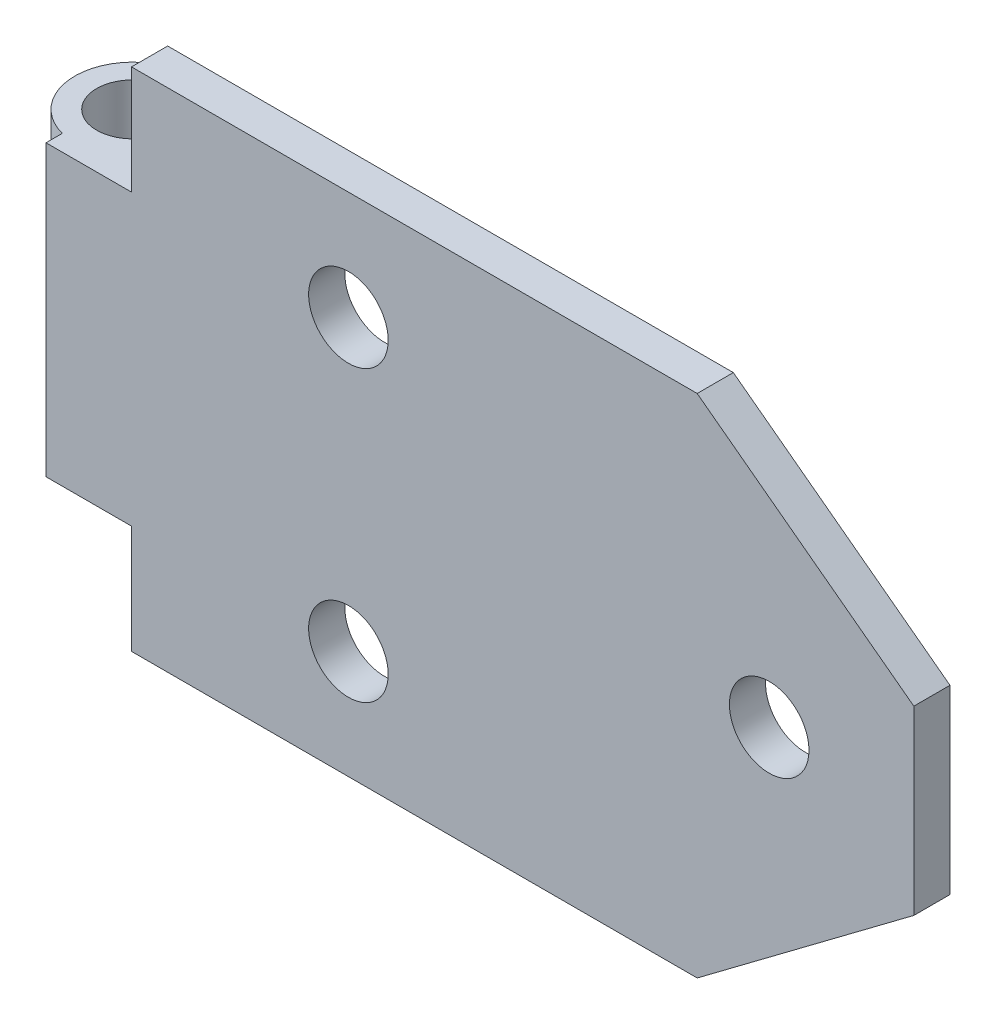
from build123d import *

# Parameters (mm, degrees)
SKETCH1_R               = 5.501178274
BOSS_EXTRUDE1_DEPTH     = 5
SKETCH2_R               = 8
SKETCH2_R_2             = 5
BOSS_EXTRUDE2_DEPTH     = 70
CUT_EXTRUDE2_DEPTH      = 140.531358483
CUT_EXTRUDE2_DEPTH_BACK = 140.531358483
SKETCH4_W               = 17.823798536
SKETCH4_H               = 15


with BuildPart() as part:
    # Sketch1 → Boss-Extrude1 (new body)
    with BuildSketch(Plane.XY):
        Polygon((0, 15), (11.823798536, 15), (11.823798536, 0), (90.043570566, 0), (120, 22.467322075), (120, 47.532677925), (90.043570566, 70), (11.823798536, 70), (11.823798536, 55), (0, 55), align=None)
        with Locations((41.814977969, 55)):
            Circle(SKETCH1_R, mode=Mode.SUBTRACT)
        with Locations((41.814977969, 15)):
            Circle(SKETCH1_R, mode=Mode.SUBTRACT)
        with Locations((100, 35)):
            Circle(SKETCH1_R, mode=Mode.SUBTRACT)
    extrude(amount=BOSS_EXTRUDE1_DEPTH)

    # Sketch2 → Boss-Extrude2 (add)
    with BuildSketch(Plane(origin=(0, 0, 0), x_dir=(1, 0, 0), z_dir=(0, 1, 0))):
        with Locations(Location((2, 5, 0), (0, 0, 270))):
            Circle(SKETCH2_R)
        with Locations(Location((2, 5, 0), (0, 0, 270))):
            Circle(SKETCH2_R_2, mode=Mode.SUBTRACT)
    extrude(amount=BOSS_EXTRUDE2_DEPTH)

    # Sketch4 → Cut-Extrude2 (cut, two sides: drawn at the far end of the back side and taken through both)
    with BuildSketch(Plane.XY.offset(-CUT_EXTRUDE2_DEPTH_BACK)):
        with Locations((2.911899268, 62.5)):
            Rectangle(SKETCH4_W, SKETCH4_H)
        with Locations((2.911899268, 7.5)):
            Rectangle(SKETCH4_W, SKETCH4_H)
    extrude(amount=CUT_EXTRUDE2_DEPTH + CUT_EXTRUDE2_DEPTH_BACK, mode=Mode.SUBTRACT)


solid = part.part
